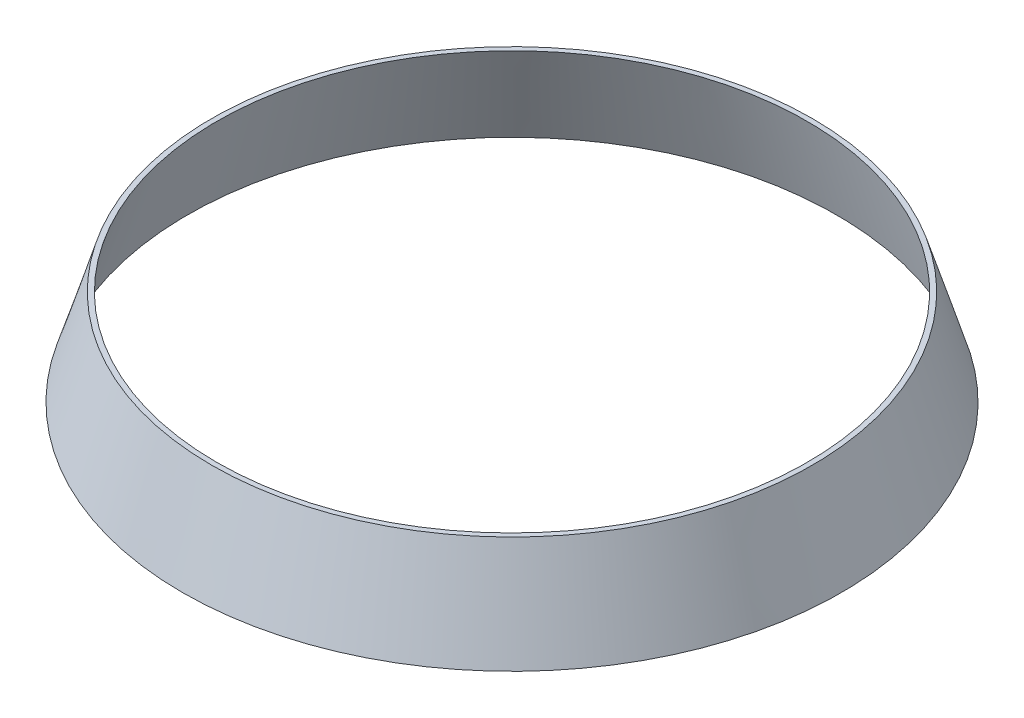
from build123d import *

# Parameters (mm, degrees)
SHELL1_T = 1


with BuildPart() as part:
    # Sketch2 → Revolve1 (revolve)
    with BuildSketch(Plane.XY, mode=Mode.PRIVATE) as revolve1_sk:
        Polygon((0, 0), (6.114613629, 20), (67.864613629, 20), (67.864613629, 0), align=None)
    revolve(revolve1_sk.sketch.rotate(Axis((67.864613629, 20, 0), (0, -1, 0)), 270), axis=Axis((67.864613629, 20, 0), (0, -1, 0)))

    # Shell1
    shell1_openings = [part.faces().sort_by_distance(p)[0] for p in [
        (67.864613629, 20, 0),
        (67.864613629, 0, 0),
    ]]
    offset(amount=SHELL1_T, openings=shell1_openings, kind=Kind.INTERSECTION)


solid = part.part
